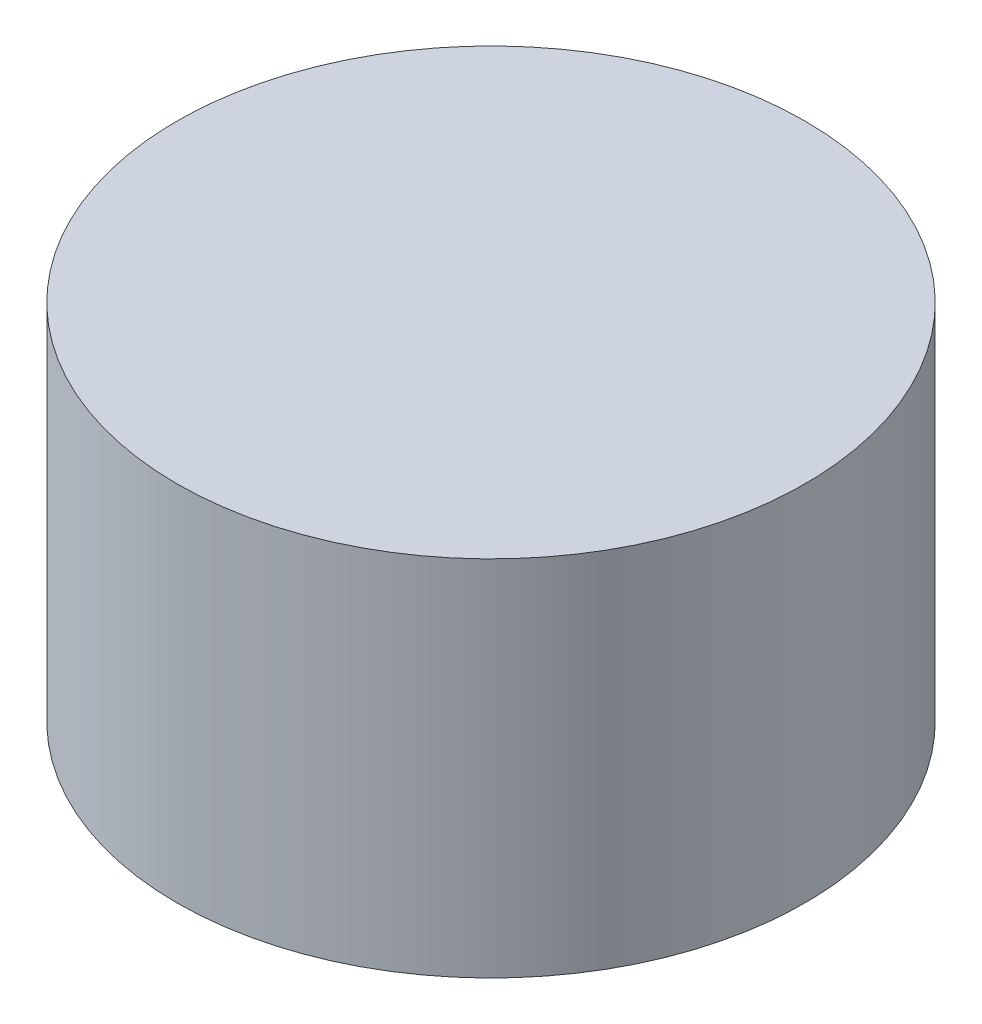
from build123d import *

# Parameters (mm, degrees)
SKETCH_1_R      = 45
EXTRUDE_1_DEPTH = 52


with BuildPart() as part:
    # Эскиз1 → Бобышка-Вытянуть1 (new body)
    with BuildSketch(Plane(origin=(0, 0, 0), x_dir=(1, 0, 0), z_dir=(0, 1, 0))):
        with Locations(Location((0, 0, 0), (0, 0, 90))):
            Circle(SKETCH_1_R)
    extrude(amount=EXTRUDE_1_DEPTH)


solid = part.part
